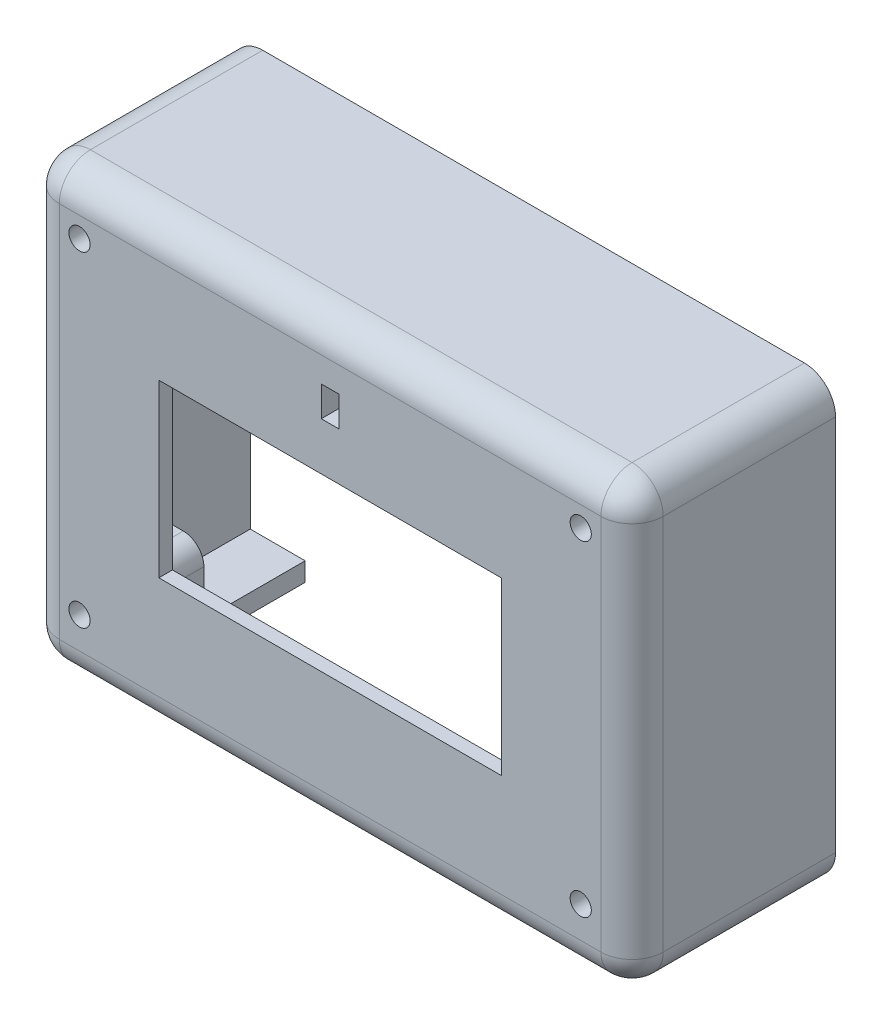
from build123d import *

# Parameters (mm, degrees)
SKETCH1_W           = 45.1
SKETCH1_H           = 63.8
SKETCH1_R           = 1.7
SKETCH1_W_2         = 0.4
SKETCH1_W_3         = 3
BOSS_EXTRUDE1_DEPTH = 6.675
SKETCH1_4_W         = 3
SKETCH1_4_H         = 63.8
BOSS_EXTRUDE2_DEPTH = 26
FILLET1_R           = 5
SKETCH3_W           = 73.36
SKETCH3_H           = 13
CUT_EXTRUDE4_DEPTH  = 3
SKETCH13_W          = 55.01
SKETCH13_H          = 27.49
CUT_EXTRUDE17_DEPTH = 112.535128995
SKETCH8_W           = 72.5
SKETCH8_H           = 48.8
CUT_EXTRUDE11_DEPTH = 1.49
SKETCH5_R           = 1.6
CUT_EXTRUDE8_DEPTH  = 4
CUT_EXTRUDE9_START  = -1.49
SKETCH7_W           = 63.21
SKETCH7_H           = 40.61
SKETCH7_W_2         = 62.41
SKETCH7_H_2         = 39.81
CUT_EXTRUDE9_DEPTH  = 3
SKETCH9_W           = 2.84
SKETCH9_H           = 4.84
SKETCH9_W_2         = 2.44
SKETCH9_H_2         = 4.44
CUT_EXTRUDE15_DEPTH = 112.535128995
SKETCH14_R          = 2.54
CUT_EXTRUDE19_DEPTH = 112.535128995
BOSS_EXTRUDE4_START = 10
SKETCH15_R          = 3.3
SKETCH15_R_2        = 1.7
BOSS_EXTRUDE4_DEPTH = 10


with BuildPart() as part:
    # Sketch1 → Boss-Extrude1 (new body)
    # profile 1 of 10: a face of its own
    with BuildSketch(Plane.XY):
        Polygon((40.25, 4.85), (85.35, 4.85), (85.75, 4.85), (85.75, 5.25), (-5.25, 5.25), (-5.25, 4.85), (-4.85, 4.85), align=None)
    # profile 2 of 10: a face of its own
    with BuildSketch(Plane.XY):
        with Locations((62.8, -27.05)):
            Rectangle(SKETCH1_W, SKETCH1_H)
        with Locations(Location((80.5, -52.3, 0), (0, 0, 180))):
            Circle(SKETCH1_R, mode=Mode.SUBTRACT)
        with Locations(Location((80.5, 0, 0), (0, 0, 180))):
            Circle(SKETCH1_R, mode=Mode.SUBTRACT)
    # profile 3 of 10: a face of its own
    with BuildSketch(Plane.XY):
        with Locations((85.55, -27.05)):
            Rectangle(SKETCH1_W_2, SKETCH1_H)
    # profile 4 of 10: a face of its own
    with BuildSketch(Plane.XY):
        Polygon((85.75, 5.25), (85.75, 4.85), (88.75, 4.85), (88.75, 8.25), (-8.25, 8.25), (-8.25, 4.85), (-5.25, 4.85), (-5.25, 5.25), align=None)
    # profile 5 of 10: a face of its own
    with BuildSketch(Plane.XY):
        with Locations((87.25, -27.05)):
            Rectangle(SKETCH1_W_3, SKETCH1_H)
    # profile 6 of 10: a face of its own
    with BuildSketch(Plane.XY):
        with Locations((17.7, -27.05)):
            Rectangle(SKETCH1_W, SKETCH1_H)
        with Locations(Location((0, -52.3, 0), (0, 0, 180))):
            Circle(SKETCH1_R, mode=Mode.SUBTRACT)
        with Locations(Location((0, 0, 0), (0, 0, 180))):
            Circle(SKETCH1_R, mode=Mode.SUBTRACT)
    # profile 7 of 10: a face of its own
    with BuildSketch(Plane.XY):
        Polygon((85.75, -58.95), (85.35, -58.95), (40.25, -58.95), (-4.85, -58.95), (-5.25, -58.95), (-5.25, -59.35), (85.75, -59.35), align=None)
    # profile 8 of 10: a face of its own
    with BuildSketch(Plane.XY):
        Polygon((88.75, -58.95), (85.75, -58.95), (85.75, -59.35), (-5.25, -59.35), (-5.25, -58.95), (-8.25, -58.95), (-8.25, -62.35), (88.75, -62.35), align=None)
    # profile 9 of 10: a face of its own
    with BuildSketch(Plane.XY):
        with Locations((-5.05, -27.05)):
            Rectangle(SKETCH1_W_2, SKETCH1_H)
    # profile 10 of 10: a face of its own
    with BuildSketch(Plane.XY):
        with Locations((-6.75, -27.05)):
            Rectangle(SKETCH1_W_3, SKETCH1_H)
    extrude(amount=BOSS_EXTRUDE1_DEPTH)

    # Sketch1<4> → Boss-Extrude2 (add)
    with BuildSketch(Plane.XY):
        Polygon((85.75, 5.25), (85.75, 4.85), (88.75, 4.85), (88.75, 8.25), (-8.25, 8.25), (-8.25, 4.85), (-5.25, 4.85), (-5.25, 5.25), align=None)
        with Locations((87.25, -27.05)):
            Rectangle(SKETCH1_4_W, SKETCH1_4_H)
        Polygon((88.75, -58.95), (85.75, -58.95), (85.75, -59.35), (-5.25, -59.35), (-5.25, -58.95), (-8.25, -58.95), (-8.25, -62.35), (88.75, -62.35), align=None)
        with Locations((-6.75, -27.05)):
            Rectangle(SKETCH1_4_W, SKETCH1_4_H)
    extrude(amount=-BOSS_EXTRUDE2_DEPTH)

    # Fillet1
    fillet1_edges = [part.edges().sort_by_distance(p)[0] for p in [
        (88.75, -62.35, -9.6625),
        (-8.25, -62.35, -9.6625),
        (-8.25, 8.25, -9.6625),
        (40.25, 8.25, 6.675),
        (88.75, 8.25, -9.6625),
        (-8.25, -27.05, 6.675),
        (40.25, -62.35, 6.675),
        (88.75, -27.05, 6.675),
    ]]
    fillet(fillet1_edges, radius=FILLET1_R)

    # Sketch3 → Cut-Extrude4 (cut)
    with BuildSketch(Plane(origin=(0, -62.35, 0), x_dir=(-1, 0, 0), z_dir=(0, -1, 0))):
        with Locations((-40.25, 19.5)):
            Rectangle(SKETCH3_W, SKETCH3_H)
    extrude(amount=-CUT_EXTRUDE4_DEPTH, mode=Mode.SUBTRACT)

    # Sketch13 → Cut-Extrude17 (cut, through all)
    with BuildSketch(Plane(origin=(0, 0, 0), x_dir=(-1, 0, 0), z_dir=(0, 0, -1))):
        with Locations((-40.25, -27.05)):
            Rectangle(SKETCH13_W, SKETCH13_H)
    extrude(amount=-CUT_EXTRUDE17_DEPTH, mode=Mode.SUBTRACT)

    # Sketch8 → Cut-Extrude11 (cut)
    with BuildSketch(Plane(origin=(0, 0, 0), x_dir=(-1, 0, 0), z_dir=(0, 0, -1))):
        with Locations((-40.25, -30.025)):
            Rectangle(SKETCH8_W, SKETCH8_H)
    extrude(amount=-CUT_EXTRUDE11_DEPTH, mode=Mode.SUBTRACT)

    # Sketch5 → Cut-Extrude8 (cut)
    with BuildSketch(Plane(origin=(0, 0, 0), x_dir=(-1, 0, 0), z_dir=(0, 0, -1))):
        with Locations((-73.05, -8.455)):
            Circle(SKETCH5_R)
        with Locations((-73.05, -51.605)):
            Circle(SKETCH5_R)
        with Locations((-7.45, -51.605)):
            Circle(SKETCH5_R)
        with Locations((-7.45, -8.455)):
            Circle(SKETCH5_R)
    extrude(amount=-CUT_EXTRUDE8_DEPTH, mode=Mode.SUBTRACT)

    # Sketch7 → Cut-Extrude9 (cut)
    # profile 1 of 2: a face of its own
    with BuildSketch(Plane(origin=(0, 0, 0), x_dir=(-1, 0, 0), z_dir=(0, 0, -1)).offset(CUT_EXTRUDE9_START)):
        with Locations((-40.25, -30.03)):
            Rectangle(SKETCH7_W, SKETCH7_H)
        with Locations((-40.25, -30.03)):
            Rectangle(SKETCH7_W_2, SKETCH7_H_2, mode=Mode.SUBTRACT)
    # profile 2 of 2: a face of its own
    with BuildSketch(Plane(origin=(0, 0, 0), x_dir=(-1, 0, 0), z_dir=(0, 0, -1)).offset(CUT_EXTRUDE9_START)):
        with Locations((-40.25, -30.03)):
            Rectangle(SKETCH7_W_2, SKETCH7_H_2)
    extrude(amount=-CUT_EXTRUDE9_DEPTH, mode=Mode.SUBTRACT)

    # Sketch9 → Cut-Extrude15 (cut, through all)
    # profile 1 of 2: a face of its own
    with BuildSketch(Plane(origin=(0, 0, 0), x_dir=(-1, 0, 0), z_dir=(0, 0, -1))):
        with Locations((-40.25, -3.205)):
            Rectangle(SKETCH9_W, SKETCH9_H)
        with Locations((-40.25, -3.205)):
            Rectangle(SKETCH9_W_2, SKETCH9_H_2, mode=Mode.SUBTRACT)
    # profile 2 of 2: a face of its own
    with BuildSketch(Plane(origin=(0, 0, 0), x_dir=(-1, 0, 0), z_dir=(0, 0, -1))):
        with Locations((-40.25, -3.205)):
            Rectangle(SKETCH9_W_2, SKETCH9_H_2)
    extrude(amount=-CUT_EXTRUDE15_DEPTH, mode=Mode.SUBTRACT)

    # Sketch14 → Cut-Extrude19 (cut, through all)
    with BuildSketch(Plane(origin=(0, 0, 0), x_dir=(-1, 0, 0), z_dir=(0, 0, -1))):
        with BuildLine():
            ThreePointArc((-30.09, -12.085), (-31.886051224, -7.748948776), (-27.55, -9.545))
            Line((-27.55, -9.545), (-27.55, -5.625))
            Line((-27.55, -5.625), (-38.83, -5.625))
            Line((-38.83, -5.625), (-38.83, -0.785))
            Line((-38.83, -0.785), (-41.67, -0.785))
            Line((-41.67, -0.785), (-41.67, -5.625))
            Line((-41.67, -5.625), (-52.95, -5.625))
            Line((-52.95, -5.625), (-52.95, -9.545))
            ThreePointArc((-52.95, -9.545), (-50.41, -7.005), (-47.87, -9.545))
            ThreePointArc((-47.87, -9.545), (-48.613948776, -11.341051224), (-50.41, -12.085))
            Line((-50.41, -12.085), (-30.09, -12.085))
        make_face()
        with BuildLine():
            Line((-38.83, -5.625), (-27.55, -5.625))
            Line((-27.55, -5.625), (-27.55, 3.155))
            ThreePointArc((-27.55, 3.155), (-31.274005151, 0.907839169), (-31.526166773, 5.25))
            Line((-31.526166773, 5.25), (-48.973833227, 5.25))
            ThreePointArc((-48.973833227, 5.25), (-48.162839169, 4.339005151), (-47.87, 3.155))
            ThreePointArc((-47.87, 3.155), (-50.41, 0.615), (-52.95, 3.155))
            Line((-52.95, 3.155), (-52.95, -5.625))
            Line((-52.95, -5.625), (-41.67, -5.625))
            Line((-41.67, -5.625), (-41.67, -0.785))
            Line((-41.67, -0.785), (-38.83, -0.785))
            Line((-38.83, -0.785), (-38.83, -5.625))
        make_face()
        with Locations((-50.41, -9.545)):
            Circle(SKETCH14_R)
        with BuildLine():
            Line((-51.846166773, 5.25), (-48.973833227, 5.25))
            ThreePointArc((-48.973833227, 5.25), (-49.658235409, 5.581200734), (-50.41, 5.695))
            ThreePointArc((-50.41, 5.695), (-51.161764591, 5.581200734), (-51.846166773, 5.25))
        make_face()
        with BuildLine():
            ThreePointArc((-47.87, 3.155), (-48.162839169, 4.339005151), (-48.973833227, 5.25))
            Line((-48.973833227, 5.25), (-51.846166773, 5.25))
            ThreePointArc((-51.846166773, 5.25), (-52.657160831, 4.339005151), (-52.95, 3.155))
            ThreePointArc((-52.95, 3.155), (-50.41, 0.615), (-47.87, 3.155))
        make_face()
        with BuildLine():
            ThreePointArc((-31.526166773, 5.25), (-31.274005151, 0.907839169), (-27.55, 3.155))
            ThreePointArc((-27.55, 3.155), (-27.842839169, 4.339005151), (-28.653833227, 5.25))
            Line((-28.653833227, 5.25), (-31.526166773, 5.25))
        make_face()
        with BuildLine():
            Line((-31.526166773, 5.25), (-28.653833227, 5.25))
            ThreePointArc((-28.653833227, 5.25), (-29.338235409, 5.581200734), (-30.09, 5.695))
            ThreePointArc((-30.09, 5.695), (-30.841764591, 5.581200734), (-31.526166773, 5.25))
        make_face()
        with Locations((-30.09, -9.545)):
            Circle(SKETCH14_R)
        with BuildLine():
            Line((-48.973833227, 5.25), (-31.526166773, 5.25))
            ThreePointArc((-31.526166773, 5.25), (-30.841764591, 5.581200734), (-30.09, 5.695))
            Line((-30.09, 5.695), (-50.41, 5.695))
            ThreePointArc((-50.41, 5.695), (-49.658235409, 5.581200734), (-48.973833227, 5.25))
        make_face()
        with BuildLine():
            Line((-27.55, -5.625), (-27.55, -9.545))
            ThreePointArc((-27.55, -9.545), (-28.293948776, -11.341051224), (-30.09, -12.085))
            Line((-30.09, -12.085), (-50.41, -12.085))
            ThreePointArc((-50.41, -12.085), (-52.206051224, -11.341051224), (-52.95, -9.545))
            Line((-52.95, -9.545), (-52.95, -5.625))
            Line((-52.95, -5.625), (-53.15, -5.625))
            Line((-53.15, -5.625), (-53.15, -9.545))
            ThreePointArc((-53.15, -9.545), (-52.34747258, -11.48247258), (-50.41, -12.285))
            Line((-50.41, -12.285), (-30.09, -12.285))
            ThreePointArc((-30.09, -12.285), (-28.15252742, -11.48247258), (-27.35, -9.545))
            Line((-27.35, -9.545), (-27.35, -5.625))
            Line((-27.35, -5.625), (-27.55, -5.625))
        make_face()
        with BuildLine():
            Line((-27.55, 3.155), (-27.55, -5.625))
            Line((-27.55, -5.625), (-27.35, -5.625))
            Line((-27.35, -5.625), (-27.35, 3.155))
            ThreePointArc((-27.35, 3.155), (-27.605417582, 4.310184058), (-28.324051246, 5.25))
            Line((-28.324051246, 5.25), (-28.653833227, 5.25))
            ThreePointArc((-28.653833227, 5.25), (-27.842839169, 4.339005151), (-27.55, 3.155))
        make_face()
        with BuildLine():
            ThreePointArc((-30.09, 5.695), (-29.338235409, 5.581200734), (-28.653833227, 5.25))
            Line((-28.653833227, 5.25), (-28.324051246, 5.25))
            ThreePointArc((-28.324051246, 5.25), (-29.149973405, 5.728703557), (-30.09, 5.895))
            Line((-30.09, 5.895), (-50.41, 5.895))
            ThreePointArc((-50.41, 5.895), (-51.350026595, 5.728703557), (-52.175948754, 5.25))
            Line((-52.175948754, 5.25), (-51.846166773, 5.25))
            ThreePointArc((-51.846166773, 5.25), (-51.161764591, 5.581200734), (-50.41, 5.695))
            Line((-50.41, 5.695), (-30.09, 5.695))
        make_face()
        with BuildLine():
            Line((-53.15, -5.625), (-52.95, -5.625))
            Line((-52.95, -5.625), (-52.95, 3.155))
            ThreePointArc((-52.95, 3.155), (-52.657160831, 4.339005151), (-51.846166773, 5.25))
            Line((-51.846166773, 5.25), (-52.175948754, 5.25))
            ThreePointArc((-52.175948754, 5.25), (-52.894582418, 4.310184058), (-53.15, 3.155))
            Line((-53.15, 3.155), (-53.15, -5.625))
        make_face()
    extrude(amount=CUT_EXTRUDE19_DEPTH, mode=Mode.SUBTRACT)

    # Sketch15 → Boss-Extrude4 (add)
    # profile 1 of 8: a face of its own
    with BuildSketch(Plane(origin=(0, 0, 0), x_dir=(-1, 0, 0), z_dir=(0, 0, -1)).offset(BOSS_EXTRUDE4_START)):
        with BuildLine():
            ThreePointArc((3.3, 0), (2.333452378, -2.333452378), (0, -3.3))
            Line((0, -3.3), (5.25, -3.3))
            Line((5.25, -3.3), (5.25, 5.25))
            Line((5.25, 5.25), (-3.3, 5.25))
            Line((-3.3, 5.25), (-3.3, 0))
            ThreePointArc((-3.3, 0), (0, 3.3), (3.3, 0))
        make_face()
    # profile 2 of 8: a face of its own
    with BuildSketch(Plane(origin=(0, 0, 0), x_dir=(-1, 0, 0), z_dir=(0, 0, -1)).offset(BOSS_EXTRUDE4_START)):
        Circle(SKETCH15_R)
        Circle(SKETCH15_R_2, mode=Mode.SUBTRACT)
    # profile 3 of 8: a face of its own
    with BuildSketch(Plane(origin=(0, 0, 0), x_dir=(-1, 0, 0), z_dir=(0, 0, -1)).offset(BOSS_EXTRUDE4_START)):
        with BuildLine():
            Line((-85.75, 5.25), (-85.75, -3.3))
            Line((-85.75, -3.3), (-80.5, -3.3))
            ThreePointArc((-80.5, -3.3), (-82.833452378, 2.333452378), (-77.2, 0))
            Line((-77.2, 0), (-77.2, 5.25))
            Line((-77.2, 5.25), (-85.75, 5.25))
        make_face()
    # profile 4 of 8: a face of its own
    with BuildSketch(Plane(origin=(0, 0, 0), x_dir=(-1, 0, 0), z_dir=(0, 0, -1)).offset(BOSS_EXTRUDE4_START)):
        with Locations((-80.5, 0)):
            Circle(SKETCH15_R)
        with Locations((-80.5, 0)):
            Circle(SKETCH15_R_2, mode=Mode.SUBTRACT)
    # profile 5 of 8: a face of its own
    with BuildSketch(Plane(origin=(0, 0, 0), x_dir=(-1, 0, 0), z_dir=(0, 0, -1)).offset(BOSS_EXTRUDE4_START)):
        with Locations((-80.5, -52.3)):
            Circle(SKETCH15_R)
        with Locations((-80.5, -52.3)):
            Circle(SKETCH15_R_2, mode=Mode.SUBTRACT)
    # profile 6 of 8: a face of its own
    with BuildSketch(Plane(origin=(0, 0, 0), x_dir=(-1, 0, 0), z_dir=(0, 0, -1)).offset(BOSS_EXTRUDE4_START)):
        with Locations((0, -52.3)):
            Circle(SKETCH15_R)
        with Locations((0, -52.3)):
            Circle(SKETCH15_R_2, mode=Mode.SUBTRACT)
    # profile 7 of 8: a face of its own
    with BuildSketch(Plane(origin=(0, 0, 0), x_dir=(-1, 0, 0), z_dir=(0, 0, -1)).offset(BOSS_EXTRUDE4_START)):
        with BuildLine():
            Line((5.25, -59.35), (5.25, -49))
            Line((5.25, -49), (0, -49))
            ThreePointArc((0, -49), (2.333452378, -49.966547622), (3.3, -52.3))
            ThreePointArc((3.3, -52.3), (0, -55.6), (-3.3, -52.3))
            Line((-3.3, -52.3), (-3.3, -59.35))
            Line((-3.3, -59.35), (5.25, -59.35))
        make_face()
    # profile 8 of 8: a face of its own
    with BuildSketch(Plane(origin=(0, 0, 0), x_dir=(-1, 0, 0), z_dir=(0, 0, -1)).offset(BOSS_EXTRUDE4_START)):
        with BuildLine():
            Line((-85.75, -59.35), (-77.2, -59.35))
            Line((-77.2, -59.35), (-77.2, -52.3))
            ThreePointArc((-77.2, -52.3), (-82.833452378, -54.633452378), (-80.5, -49))
            Line((-80.5, -49), (-85.75, -49))
            Line((-85.75, -49), (-85.75, -59.35))
        make_face()
    extrude(amount=-BOSS_EXTRUDE4_DEPTH)


solid = part.part
